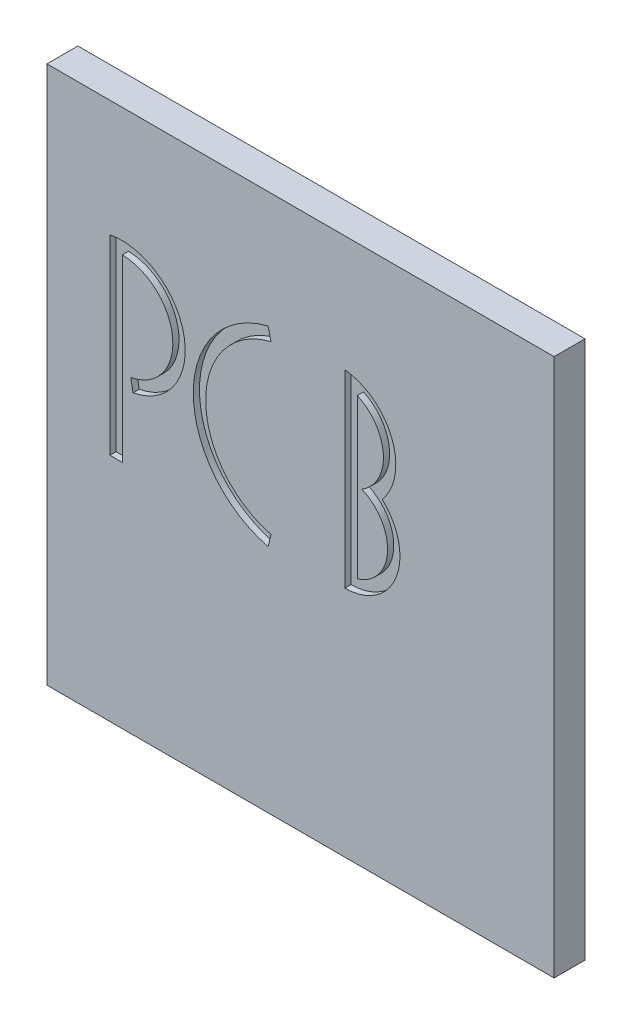
from build123d import *

# Parameters (mm, degrees)
ESQUISSE1_W             = 82
ESQUISSE1_H             = 87
BOSS_EXTRU_1_DEPTH      = 5
ENL_V_MAT_EXTRU_1_DEPTH = 1


with BuildPart() as part:
    # Esquisse1 → Boss.-Extru.1 (new body)
    with BuildSketch(Plane.XY):
        Rectangle(ESQUISSE1_W, ESQUISSE1_H)
    extrude(amount=BOSS_EXTRU_1_DEPTH)

    # Esquisse2 → Enlèv. mat.-Extru.1 (cut)
    # profile 1 of 3: a face of its own
    with BuildSketch(Plane.XY.offset(5)):
        with BuildLine():
            Line((-30.820713327, 24.668633563), (-30.820713327, -6.212394271))
            Line((-30.820713327, -6.212394271), (-28.820713327, -6.212394271))
            Line((-28.820713327, -6.212394271), (-28.820713327, 22.838674714))
            ThreePointArc((-28.820713327, 22.838674714), (-20.675920897, 15.227477844), (-27.444134647, 6.369755555))
            Line((-27.444134647, 6.369755555), (-27.081213863, 4.402959047))
            ThreePointArc((-27.081213863, 4.402959047), (-18.818126337, 16.405546037), (-30.820713327, 24.668633563))
        make_face()
    # profile 2 of 3: a face of its own
    with BuildSketch(Plane.XY.offset(5)):
        with BuildLine():
            Line((-5.247362152, -6.212394271), (-4.768401098, -4.270591936))
            ThreePointArc((-4.768401098, -4.270591936), (-15.342116904, 9.228119646), (-4.768401098, 22.726831228))
            Line((-4.768401098, 22.726831228), (-5.247362152, 24.668633563))
            ThreePointArc((-5.247362152, 24.668633563), (-17.342116904, 9.228119646), (-5.247362152, -6.212394271))
        make_face()
    # profile 3 of 3: a face of its own
    with BuildSketch(Plane.XY.offset(5)):
        with BuildLine():
            Line((7.177426391, 24.753119096), (7.177426391, -5.822234801))
            ThreePointArc((7.177426391, -5.822234801), (15.465789743, -0.161602052), (13.20887714, 9.618279116))
            ThreePointArc((13.20887714, 9.618279116), (14.745705745, 18.999957145), (7.177426391, 24.753119096))
        make_face()
        with BuildLine():
            Line((9.177426391, 22.155705275), (9.177426391, -3.525944184))
            ThreePointArc((9.177426391, -3.525944184), (14.064473769, 2.682629125), (9.916217396, 9.407328648))
            ThreePointArc((9.916217396, 9.407328648), (13.388733311, 16.004162532), (9.177426391, 22.155705275))
        make_face(mode=Mode.SUBTRACT)
    extrude(amount=-ENL_V_MAT_EXTRU_1_DEPTH, mode=Mode.SUBTRACT)


solid = part.part
